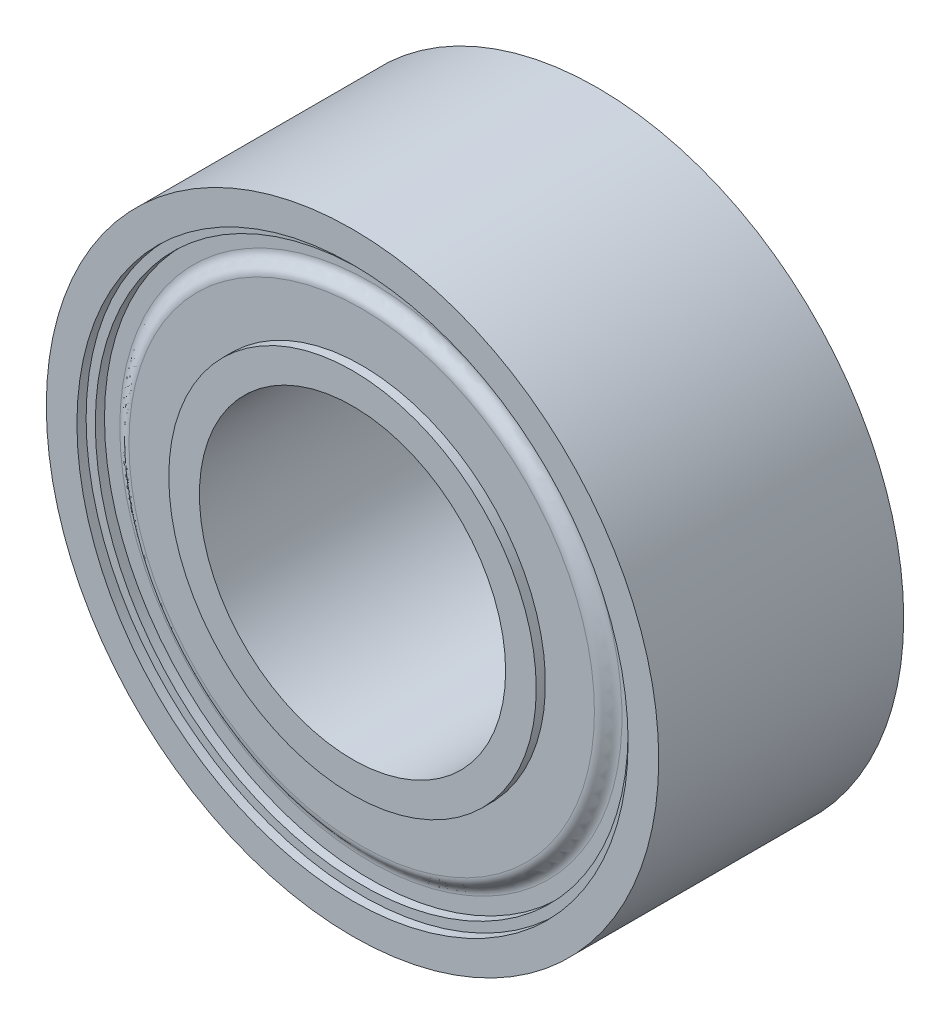
from build123d import *

# Parameters (mm, degrees)
SKETCH_1_R        = 5
SKETCH_1_R_2      = 4.5
EXTRUDE_1_DEPTH   = 2
SKETCH_1_R_3      = 3
SKETCH_1_R_4      = 2.5
EXTRUDE_1_2_DEPTH = 2


with BuildPart() as part:
    # Эскиз1 → Бобышка-Вытянуть1 (new, symmetric)
    with BuildSketch(Plane.XY):
        Circle(SKETCH_1_R)
        Circle(SKETCH_1_R_2, mode=Mode.SUBTRACT)
    extrude(amount=EXTRUDE_1_DEPTH, both=True)



with BuildPart() as body_2:
    # Эскиз1 → Extrude 1 2 (new, symmetric)
    with BuildSketch(Plane.XY):
        Circle(SKETCH_1_R_3)
        Circle(SKETCH_1_R_4, mode=Mode.SUBTRACT)
    extrude(amount=EXTRUDE_1_2_DEPTH, both=True)


with BuildPart() as part_1:
    add(part.part)

    add(body_2.part)  # Повернуть1 merges body 2
    # Эскиз3 → Повернуть1 (revolve)
    with BuildSketch(Plane(origin=(0, 0, 0), x_dir=(1, 0, 0), z_dir=(0, 1, 0)), mode=Mode.PRIVATE) as revolve_1_sk:
        with BuildLine():
            Line((4.35, -1.7), (4.1, -1.7))
            add(Edge.make_bspline(
                [(3.8, -1.85), (3.95, -1.85), (3.95, -1.7), (4.1, -1.7)],
                knots=[0, 0, 0, 0, 1, 1, 1, 1], degree=3))
            Line((3.8, -1.85), (3, -1.85))
            Line((3, -1.85), (3, 0))
            Line((3, 0), (3, 1.85))
            Line((3, 1.85), (3.8, 1.85))
            add(Edge.make_bspline(
                [(3.8, 1.85), (3.95, 1.85), (3.95, 1.7), (4.1, 1.7)],
                knots=[0, 0, 0, 0, 1, 1, 1, 1], degree=3))
            Line((4.1, 1.7), (4.35, 1.7))
            Line((4.35, 1.7), (4.35, 1.85))
            Line((4.35, 1.85), (4.5, 1.85))
            Line((4.5, 1.85), (4.5, 0))
            Line((4.5, 0), (4.5, -1.85))
            Line((4.5, -1.85), (4.35, -1.85))
            Line((4.35, -1.85), (4.35, -1.7))
        make_face()
    revolve(revolve_1_sk.sketch.rotate(Axis((0, 0, -2), (0, 0, 1)), 180), axis=Axis((0, 0, -2), (0, 0, 1)))


solid = part_1.part
